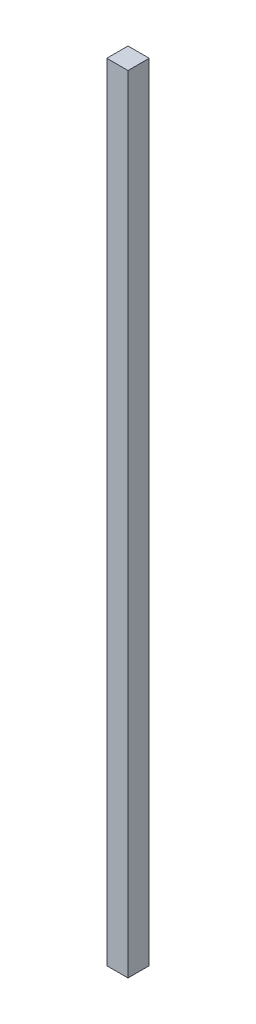
from build123d import *

# Parameters (mm, degrees)
SKETCH1_W           = 10
SKETCH1_H           = 370
BOSS_EXTRUDE1_DEPTH = 10


with BuildPart() as part:
    # Sketch1 → Boss-Extrude1 (new body)
    with BuildSketch(Plane.XY):
        with Locations((5, -185)):
            Rectangle(SKETCH1_W, SKETCH1_H)
    extrude(amount=BOSS_EXTRUDE1_DEPTH)


solid = part.part
